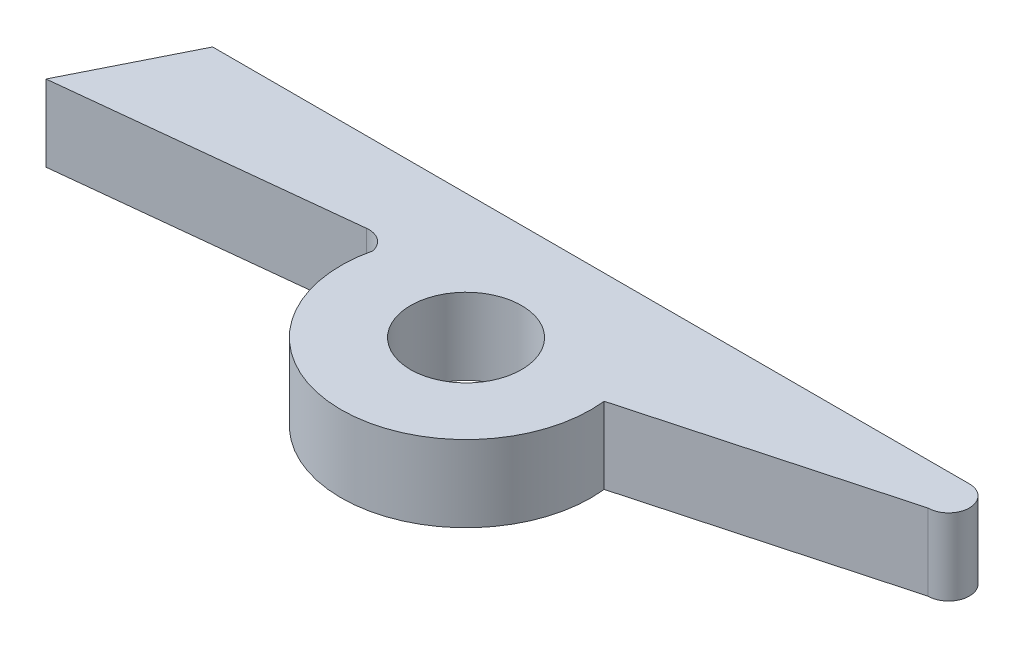
from build123d import *

# Parameters (mm, degrees)
SCHIZZO1_R                   = 4
ESTRUSIONE_ESTRUSIONE1_DEPTH = 5.5


with BuildPart() as part:
    # Schizzo1 → Estrusione-Estrusione1 (new body)
    with BuildSketch(Plane(origin=(0, 0, 0), x_dir=(1, 0, 0), z_dir=(0, 1, 0))):
        with BuildLine():
            Line((-31.25, 1), (-10.389548196, 3.231490655))
            ThreePointArc((-10.389548196, 3.231490655), (-9.349630999, 2.954475369), (-8.762875038, 2.0523209))
            ThreePointArc((-8.762875038, 2.0523209), (-0.533351916, -8.98418253), (8.944145279, 1.001131971))
            Line((8.944145279, 1.001131971), (27.25, 6))
            ThreePointArc((27.25, 6), (28.75, 7.5), (27.25, 9))
            Line((27.25, 9), (-27.25, 9))
            Line((-27.25, 9), (-31.25, 1))
        make_face()
        with Locations(Location((0, 0, 0), (0, 0, 270))):
            Circle(SCHIZZO1_R, mode=Mode.SUBTRACT)
    extrude(amount=ESTRUSIONE_ESTRUSIONE1_DEPTH)


solid = part.part
